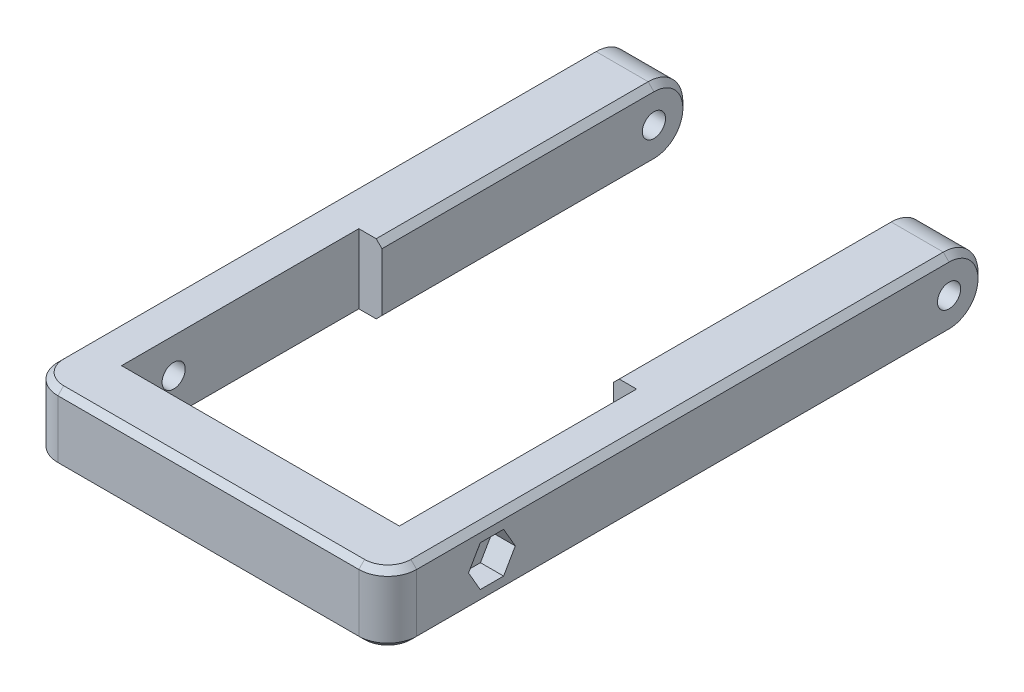
from build123d import *

# Parameters (mm, degrees)
BOSS_EXTRUDE1_DEPTH = 6
SKETCH2_R           = 2
CUT_EXTRUDE1_DEPTH  = 121.370262108
SKETCH3_R           = 2
CUT_EXTRUDE2_DEPTH  = 121.370262108
CUT_EXTRUDE3_DEPTH  = 4
SKETCH6_W           = 48
SKETCH6_H           = 40
CUT_EXTRUDE4_DEPTH  = 109.231233939
FILLET1_R           = 5
CHAMFER1_SIZE       = 1


with BuildPart() as part:
    # Sketch1 → Boss-Extrude1 (new, symmetric)
    with BuildSketch(Plane(origin=(0, 0, 0), x_dir=(1, 0, 0), z_dir=(0, 1, 0))):
        Polygon((20, 103), (31, 103), (31, 0), (-31, 0), (-31, 103), (-20, 103), (-20, 10), (20, 10), align=None)
    extrude(amount=BOSS_EXTRUDE1_DEPTH, both=True)

    # Sketch2 → Cut-Extrude1 (cut, through all)
    with BuildSketch(Plane(origin=(31, 0, 0), x_dir=(0, 0, -1), z_dir=(1, 0, 0))):
        with Locations((97, 0)):
            Circle(SKETCH2_R)
        with BuildLine():
            Line((97, 6), (104, 6))
            Line((104, 6), (104, -6))
            Line((104, -6), (97, -6))
            ThreePointArc((97, -6), (103, 0), (97, 6))
        make_face()
    extrude(amount=-CUT_EXTRUDE1_DEPTH, mode=Mode.SUBTRACT)

    # Sketch3 → Cut-Extrude2 (cut, through all)
    with BuildSketch(Plane(origin=(31, 0, 0), x_dir=(0, 0, -1), z_dir=(1, 0, 0))):
        with Locations((18, 0)):
            Circle(SKETCH3_R)
    extrude(amount=-CUT_EXTRUDE2_DEPTH, mode=Mode.SUBTRACT)

    # Sketch4 → Cut-Extrude3 (cut)
    with BuildSketch(Plane(origin=(31, 0, 0), x_dir=(0, 0, -1), z_dir=(1, 0, 0))):
        Polygon((22.041451884, 0), (20.020725942, 3.5), (15.979274058, 3.5), (13.958548116, 0), (15.979274058, -3.5), (20.020725942, -3.5), align=None)
    cut_extrude3 = extrude(amount=-CUT_EXTRUDE3_DEPTH, mode=Mode.SUBTRACT)

    # Mirror1: Cut-Extrude3 across plane
    add(cut_extrude3.mirror(Plane(origin=(0, 0, 0), x_dir=(0, 0, 1), z_dir=(1, 0, 0))), mode=Mode.SUBTRACT)

    # Sketch6 → Cut-Extrude4 (cut, through all)
    with BuildSketch(Plane(origin=(0, 6, 0), x_dir=(1, 0, 0), z_dir=(0, 1, 0))):
        with Locations((0, 30)):
            Rectangle(SKETCH6_W, SKETCH6_H)
    extrude(amount=-CUT_EXTRUDE4_DEPTH, mode=Mode.SUBTRACT)

    # Fillet1
    fillet1_edges = [part.edges().sort_by_distance(p)[0] for p in [
        (31, 0, 0),
        (-31, 0, 0),
    ]]
    fillet(fillet1_edges, radius=FILLET1_R)

    # Chamfer1
    chamfer1_edges = [part.edges().sort_by_distance(p)[0] for p in [
        (-20, -6, -73.5),
        (-20, 6, -73.5),
        (0, -6, 0),
        (0, 6, 0),
        (31, -6, -51),
        (29.535533906, -6, -1.464466094),
        (-29.535533906, -6, -1.464466094),
        (31, 6, -51),
        (29.535533906, 6, -1.464466094),
        (-29.535533906, 6, -1.464466094),
        (0, 6, -10),
        (-31, -6, -51),
        (20, -6, -73.5),
        (-31, 6, -51),
        (20, 6, -73.5),
        (20, 0, -103),
        (-20, 0, -103),
        (-31, 0, -103),
        (31, 0, -103),
        (0, -6, -10),
    ]]
    chamfer(chamfer1_edges, length=CHAMFER1_SIZE)


solid = part.part
